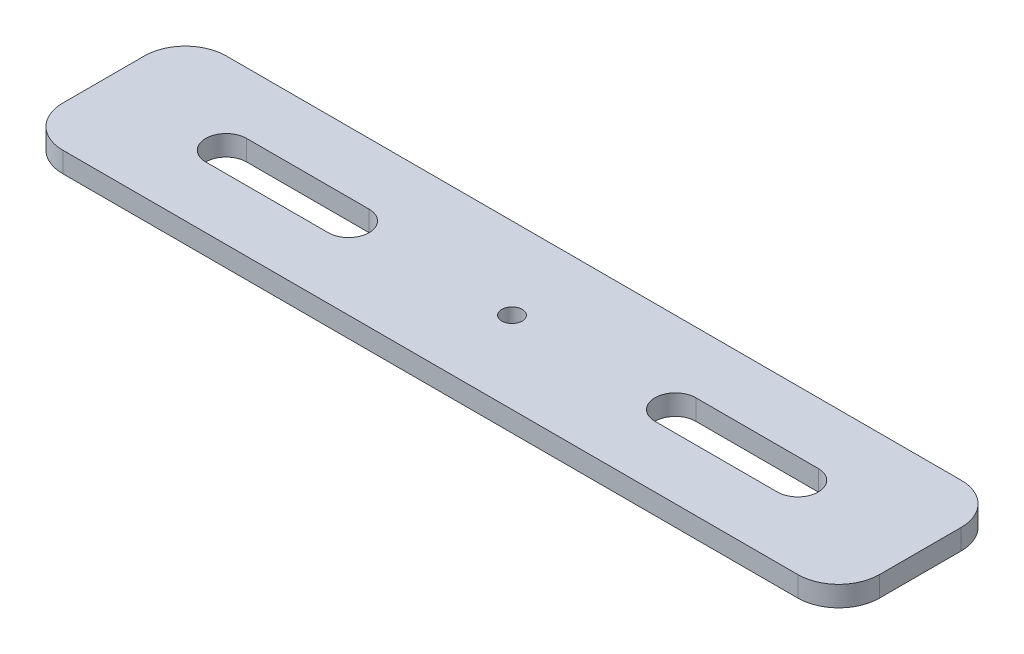
from build123d import *

# Parameters (mm, degrees)
SKETCH_1_W      = 40
SKETCH_1_H      = 40
SKETCH_1_R      = 2.5
EXTRUDE_3_DEPTH = 5


with BuildPart() as part:
    # 草图1 → 凸台-拉伸3 (new body)
    # profile 1 of 3: a face of its own
    with BuildSketch(Plane(origin=(0, 0, 0), x_dir=(1, 0, 0), z_dir=(0, 1, 0))):
        with BuildLine():
            Line((-100, 10), (-100, -10))
            ThreePointArc((-100, -10), (-97.071067812, -17.071067812), (-90, -20))
            Line((-90, -20), (-20, -20))
            Line((-20, -20), (-20, 20))
            Line((-20, 20), (-90, 20))
            ThreePointArc((-90, 20), (-97.071067812, 17.071067812), (-100, 10))
        make_face()
        with BuildLine():
            ThreePointArc((-70, 5), (-75, 0), (-70, -5))
            Line((-70, -5), (-40, -5))
            ThreePointArc((-40, -5), (-35, 0), (-40, 5))
            Line((-40, 5), (-70, 5))
        make_face(mode=Mode.SUBTRACT)
    # profile 2 of 3: a face of its own
    with BuildSketch(Plane(origin=(0, 0, 0), x_dir=(1, 0, 0), z_dir=(0, 1, 0))):
        Rectangle(SKETCH_1_W, SKETCH_1_H)
        with Locations(Location((0, 0, 0), (0, 0, 270))):
            Circle(SKETCH_1_R, mode=Mode.SUBTRACT)
    # profile 3 of 3: a face of its own
    with BuildSketch(Plane(origin=(0, 0, 0), x_dir=(1, 0, 0), z_dir=(0, 1, 0))):
        with BuildLine():
            ThreePointArc((90, 20), (97.071067812, 17.071067812), (100, 10))
            Line((100, 10), (100, -10))
            ThreePointArc((100, -10), (97.071067812, -17.071067812), (90, -20))
            Line((90, -20), (20, -20))
            Line((20, -20), (20, 20))
            Line((20, 20), (90, 20))
        make_face()
        with BuildLine():
            ThreePointArc((70, -5), (75, 0), (70, 5))
            Line((70, 5), (40, 5))
            ThreePointArc((40, 5), (35, 0), (40, -5))
            Line((40, -5), (70, -5))
        make_face(mode=Mode.SUBTRACT)
    extrude(amount=EXTRUDE_3_DEPTH)


solid = part.part
